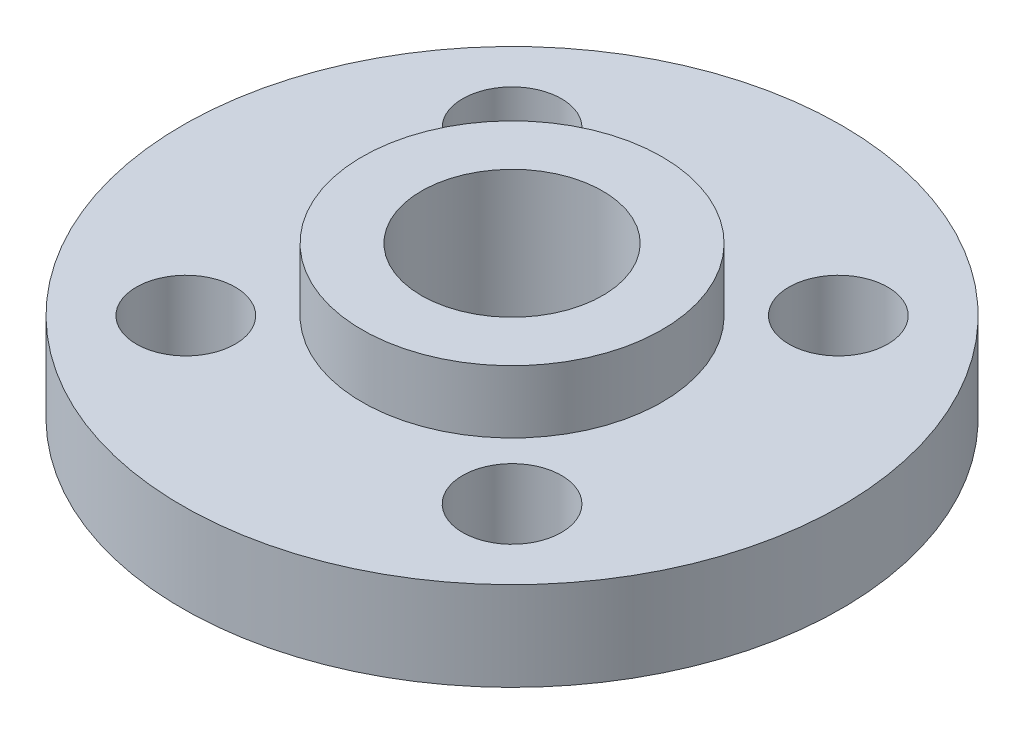
from build123d import *

# Parameters (mm, degrees)
ESQUISSE1_R                   = 10
ESQUISSE1_R_2                 = 1.6
BOSS_EXTRU_1_DEPTH            = 2.7
ESQUISSE2_R                   = 4.55
BOSS_EXTRU_2_DEPTH            = 1.9
ESQUISSE5_R                   = 2.75
ENL_V_MAT_EXTRU_1_DEPTH       = 4
DIAM_TRE_DU_PER_AGE_3_0_3_1_D = 3


with BuildPart() as part:
    # Esquisse1 → Boss.-Extru.1 (new body)
    with BuildSketch(Plane(origin=(0, 0, 0), x_dir=(1, 0, 0), z_dir=(0, 1, 0))):
        with Locations(Location((0, 0, 0), (0, 0, 90))):
            Circle(ESQUISSE1_R)
        with Locations(Location((0, 0, 0), (0, 0, 90))):
            Circle(ESQUISSE1_R_2, mode=Mode.SUBTRACT)
    extrude(amount=BOSS_EXTRU_1_DEPTH)

    # Esquisse2 → Boss.-Extru.2 (add)
    with BuildSketch(Plane(origin=(0, 2.7, 0), x_dir=(1, 0, 0), z_dir=(0, 1, 0))):
        with Locations(Location((0, 0, 0), (0, 0, 90))):
            Circle(ESQUISSE2_R)
    extrude(amount=BOSS_EXTRU_2_DEPTH)

    # Esquisse5 → Enlèv. mat.-Extru.1 (cut)
    with BuildSketch(Plane(origin=(0, 4.6, 0), x_dir=(1, 0, 0), z_dir=(0, 1, 0))):
        with Locations(Location((0, 0, 0), (0, 0, 270))):
            Circle(ESQUISSE5_R)
    extrude(amount=-ENL_V_MAT_EXTRU_1_DEPTH, mode=Mode.SUBTRACT)

    # Diamètre du perçage Ø3.0 (3)1 (through all)
    with Locations(Plane(origin=(0, 2.7, 0), x_dir=(1, 0, 0), z_dir=(0, 1, 0))):
        with Locations((4.949747468, -4.949747468), (-4.949747468, -4.949747468), (-4.949747468, 4.949747468), (4.949747468, 4.949747468)):
            Hole(DIAM_TRE_DU_PER_AGE_3_0_3_1_D / 2)


solid = part.part
